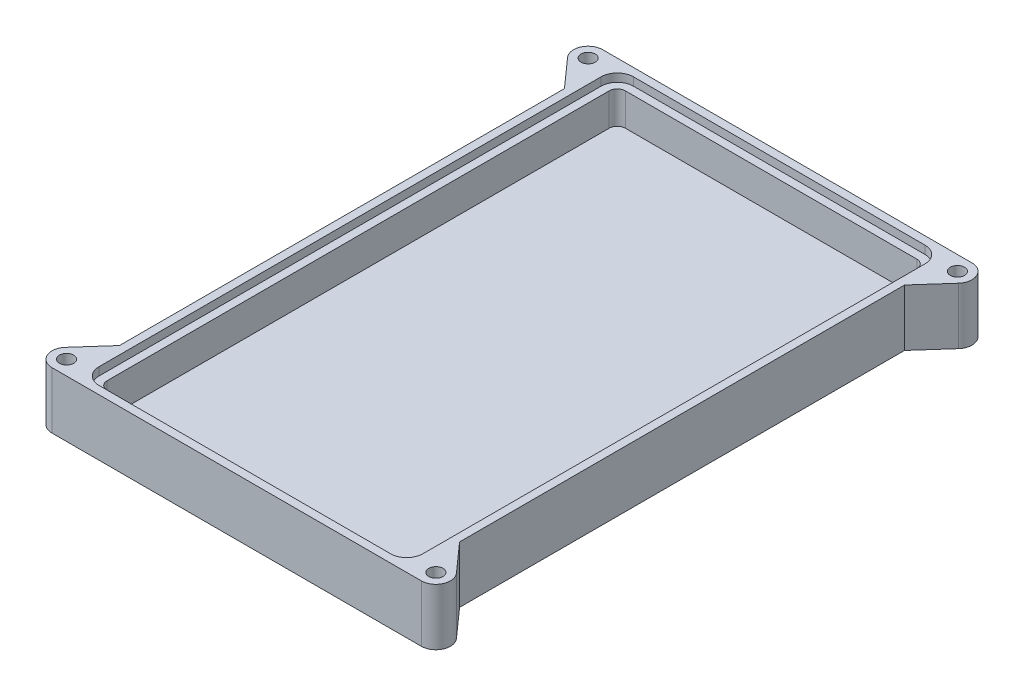
from build123d import *

# Parameters (mm, degrees)
SALIENTE_EXTRUIR2_DEPTH   = 11
SALIENTE_EXTRUIR3_DEPTH   = 25.5
SALIENTE_EXTRUIR4_DEPTH   = 2.5
SALIENTE_EXTRUIR5_DEPTH   = 36.5
SIMETR_A2_COPY_1_DEPTH    = 36.5
CROQUIS6_R                = 2.2
CORTAR_EXTRUIR2_DEPTH     = 112.083302076
SIMETR_A4_COPY_1_SKETCH_R = 2.2
SIMETR_A4_COPY_1_DEPTH    = 112.083302076
CORTAR_EXTRUIR3_DEPTH     = 6
CORTAR_EXTRUIR4_START     = -18
CORTAR_EXTRUIR4_DEPTH     = 18
CORTAR_EXTRUIR5_START     = -13
CORTAR_EXTRUIR5_DEPTH     = 13


with BuildPart() as part:
    # Croquis1 → Saliente-Extruir2 (new body)
    # profile 1 of 3: a face of its own
    with BuildSketch(Plane(origin=(0, 0, 0), x_dir=(1, 0, 0), z_dir=(0, 1, 0))):
        with BuildLine():
            Line((-45, 85), (45, 85))
            ThreePointArc((45, 85), (50.303300859, 82.803300859), (52.5, 77.5))
            Line((52.5, 77.5), (52.5, -77.5))
            ThreePointArc((52.5, -77.5), (50.303300859, -82.803300859), (45, -85))
            Line((45, -85), (-45, -85))
            ThreePointArc((-45, -85), (-50.303300859, -82.803300859), (-52.5, -77.5))
            Line((-52.5, -77.5), (-52.5, 77.5))
            ThreePointArc((-52.5, 77.5), (-50.303300859, 82.803300859), (-45, 85))
        make_face()
        with BuildLine():
            ThreePointArc((-45, 82.5), (-48.535533906, 81.035533906), (-50, 77.5))
            Line((-50, 77.5), (-50, -77.5))
            ThreePointArc((-50, -77.5), (-48.535533906, -81.035533906), (-45, -82.5))
            Line((-45, -82.5), (45, -82.5))
            ThreePointArc((45, -82.5), (48.535533906, -81.035533906), (50, -77.5))
            Line((50, -77.5), (50, 77.5))
            ThreePointArc((50, 77.5), (48.535533906, 81.035533906), (45, 82.5))
            Line((45, 82.5), (-45, 82.5))
        make_face(mode=Mode.SUBTRACT)
    # profile 2 of 3: a face of its own
    with BuildSketch(Plane(origin=(0, 0, 0), x_dir=(1, 0, 0), z_dir=(0, 1, 0))):
        with BuildLine():
            Line((-45, 82.5), (45, 82.5))
            ThreePointArc((45, 82.5), (48.535533906, 81.035533906), (50, 77.5))
            Line((50, 77.5), (50, -77.5))
            ThreePointArc((50, -77.5), (48.535533906, -81.035533906), (45, -82.5))
            Line((45, -82.5), (-45, -82.5))
            ThreePointArc((-45, -82.5), (-48.535533906, -81.035533906), (-50, -77.5))
            Line((-50, -77.5), (-50, 77.5))
            ThreePointArc((-50, 77.5), (-48.535533906, 81.035533906), (-45, 82.5))
        make_face()
        with BuildLine():
            ThreePointArc((45, -80), (46.767766953, -79.267766953), (47.5, -77.5))
            Line((47.5, -77.5), (47.5, 77.5))
            ThreePointArc((47.5, 77.5), (46.767766953, 79.267766953), (45, 80))
            Line((45, 80), (-45, 80))
            ThreePointArc((-45, 80), (-46.767766953, 79.267766953), (-47.5, 77.5))
            Line((-47.5, 77.5), (-47.5, -77.5))
            ThreePointArc((-47.5, -77.5), (-46.767766953, -79.267766953), (-45, -80))
            Line((-45, -80), (45, -80))
        make_face(mode=Mode.SUBTRACT)
    # profile 3 of 3: a face of its own
    with BuildSketch(Plane(origin=(0, 0, 0), x_dir=(1, 0, 0), z_dir=(0, 1, 0))):
        with BuildLine():
            Line((-45, -80), (45, -80))
            ThreePointArc((45, -80), (46.767766953, -79.267766953), (47.5, -77.5))
            Line((47.5, -77.5), (47.5, 77.5))
            ThreePointArc((47.5, 77.5), (46.767766953, 79.267766953), (45, 80))
            Line((45, 80), (-45, 80))
            ThreePointArc((-45, 80), (-46.767766953, 79.267766953), (-47.5, 77.5))
            Line((-47.5, 77.5), (-47.5, -77.5))
            ThreePointArc((-47.5, -77.5), (-46.767766953, -79.267766953), (-45, -80))
        make_face()
    extrude(amount=SALIENTE_EXTRUIR2_DEPTH)

    # Croquis2 → Saliente-Extruir3 (add)
    # profile 1 of 2: a face of its own
    with BuildSketch(Plane(origin=(0, 11, 0), x_dir=(1, 0, 0), z_dir=(0, 1, 0))):
        with BuildLine():
            ThreePointArc((52.5, 77.5), (50.303300859, 82.803300859), (45, 85))
            Line((45, 85), (-45, 85))
            ThreePointArc((-45, 85), (-50.303300859, 82.803300859), (-52.5, 77.5))
            Line((-52.5, 77.5), (-52.5, -77.5))
            ThreePointArc((-52.5, -77.5), (-50.303300859, -82.803300859), (-45, -85))
            Line((-45, -85), (45, -85))
            ThreePointArc((45, -85), (50.303300859, -82.803300859), (52.5, -77.5))
            Line((52.5, -77.5), (52.5, 77.5))
        make_face()
        with BuildLine():
            ThreePointArc((-45, 82.5), (-48.535533906, 81.035533906), (-50, 77.5))
            Line((-50, 77.5), (-50, -77.5))
            ThreePointArc((-50, -77.5), (-48.535533906, -81.035533906), (-45, -82.5))
            Line((-45, -82.5), (45, -82.5))
            ThreePointArc((45, -82.5), (48.535533906, -81.035533906), (50, -77.5))
            Line((50, -77.5), (50, 77.5))
            ThreePointArc((50, 77.5), (48.535533906, 81.035533906), (45, 82.5))
            Line((45, 82.5), (-45, 82.5))
        make_face(mode=Mode.SUBTRACT)
    # profile 2 of 2: a face of its own
    with BuildSketch(Plane(origin=(0, 11, 0), x_dir=(1, 0, 0), z_dir=(0, 1, 0))):
        with BuildLine():
            Line((45, 82.5), (-45, 82.5))
            ThreePointArc((-45, 82.5), (-48.535533906, 81.035533906), (-50, 77.5))
            Line((-50, 77.5), (-50, -77.5))
            ThreePointArc((-50, -77.5), (-48.535533906, -81.035533906), (-45, -82.5))
            Line((-45, -82.5), (45, -82.5))
            ThreePointArc((45, -82.5), (48.535533906, -81.035533906), (50, -77.5))
            Line((50, -77.5), (50, 77.5))
            ThreePointArc((50, 77.5), (48.535533906, 81.035533906), (45, 82.5))
        make_face()
        with BuildLine():
            ThreePointArc((-45, 80), (-46.767766953, 79.267766953), (-47.5, 77.5))
            Line((-47.5, 77.5), (-47.5, -77.5))
            ThreePointArc((-47.5, -77.5), (-46.767766953, -79.267766953), (-45, -80))
            Line((-45, -80), (45, -80))
            ThreePointArc((45, -80), (46.767766953, -79.267766953), (47.5, -77.5))
            Line((47.5, -77.5), (47.5, 77.5))
            ThreePointArc((47.5, 77.5), (46.767766953, 79.267766953), (45, 80))
            Line((45, 80), (-45, 80))
        make_face(mode=Mode.SUBTRACT)
    extrude(amount=SALIENTE_EXTRUIR3_DEPTH)

    # Croquis3 → Saliente-Extruir4 (add)
    with BuildSketch(Plane(origin=(0, 36.5, 0), x_dir=(1, 0, 0), z_dir=(0, 1, 0))):
        with BuildLine():
            Line((45, 82.5), (-45, 82.5))
            ThreePointArc((-45, 82.5), (-48.535533906, 81.035533906), (-50, 77.5))
            Line((-50, 77.5), (-50, -77.5))
            ThreePointArc((-50, -77.5), (-48.535533906, -81.035533906), (-45, -82.5))
            Line((-45, -82.5), (45, -82.5))
            ThreePointArc((45, -82.5), (48.535533906, -81.035533906), (50, -77.5))
            Line((50, -77.5), (50, 77.5))
            ThreePointArc((50, 77.5), (48.535533906, 81.035533906), (45, 82.5))
        make_face()
        with BuildLine():
            Line((-47.5, -77.5), (-47.5, 77.5))
            ThreePointArc((-47.5, 77.5), (-46.767766953, 79.267766953), (-45, 80))
            Line((-45, 80), (45, 80))
            ThreePointArc((45, 80), (46.767766953, 79.267766953), (47.5, 77.5))
            Line((47.5, 77.5), (47.5, -77.5))
            ThreePointArc((47.5, -77.5), (46.767766953, -79.267766953), (45, -80))
            Line((45, -80), (-45, -80))
            ThreePointArc((-45, -80), (-46.767766953, -79.267766953), (-47.5, -77.5))
        make_face(mode=Mode.SUBTRACT)
    extrude(amount=SALIENTE_EXTRUIR4_DEPTH)

    # Croquis4 → Saliente-Extruir5 (add)
    with BuildSketch(Plane.XZ):
        with BuildLine():
            Line((57, 85), (45, 85))
            ThreePointArc((45, 85), (50.303300859, 82.803300859), (52.5, 77.5))
            Line((52.5, 77.5), (52.5, 68.686877301))
            Line((52.5, 68.686877301), (60.359510947, 77.506058418))
            ThreePointArc((60.359510947, 77.506058418), (61.10625968, 82.340823577), (57, 85))
        make_face()
    saliente_extruir5 = extrude(amount=-SALIENTE_EXTRUIR5_DEPTH)

    # Simetría1: Saliente-Extruir5 across plane
    add(saliente_extruir5.mirror(Plane(origin=(0, 0, 0), x_dir=(0, 0, 1), z_dir=(1, 0, 0))))

    # Simetría2: Saliente-Extruir5 across plane
    add(saliente_extruir5.mirror(Plane.XY))

    # Simetría2 copy 1 sketch → Simetría2 copy 1 (add)
    with BuildSketch(Plane(origin=(0, 0, 0), x_dir=(-1, 0, 0), z_dir=(0, -1, 0))):
        with BuildLine():
            Line((57, 85), (45, 85))
            ThreePointArc((45, 85), (50.303300859, 82.803300859), (52.5, 77.5))
            Line((52.5, 77.5), (52.5, 68.686877301))
            Line((52.5, 68.686877301), (60.359510947, 77.506058418))
            ThreePointArc((60.359510947, 77.506058418), (61.10625968, 82.340823577), (57, 85))
        make_face()
    extrude(amount=-SIMETR_A2_COPY_1_DEPTH)

    # Croquis6 → Cortar-Extruir2 (cut, through all)
    with BuildSketch(Plane(origin=(0, 36.5, 0), x_dir=(1, 0, 0), z_dir=(0, 1, 0))):
        with Locations(Location((57, 80.5, 0), (0, 0, 270))):
            Circle(CROQUIS6_R)
    cortar_extruir2 = extrude(amount=-CORTAR_EXTRUIR2_DEPTH, mode=Mode.SUBTRACT)

    # Simetría3: Cortar-Extruir2 across plane
    add(cortar_extruir2.mirror(Plane(origin=(0, 0, 0), x_dir=(0, 0, 1), z_dir=(1, 0, 0))), mode=Mode.SUBTRACT)

    # Simetría4: Cortar-Extruir2 across plane
    add(cortar_extruir2.mirror(Plane.XY), mode=Mode.SUBTRACT)

    # Simetría4 copy 1 sketch → Simetría4 copy 1 (cut, through all)
    with BuildSketch(Plane(origin=(0, 36.5, 0), x_dir=(-1, 0, 0), z_dir=(0, 1, 0))):
        with Locations(Location((57, 80.5, 0), (0, 0, 270))):
            Circle(SIMETR_A4_COPY_1_SKETCH_R)
    extrude(amount=-SIMETR_A4_COPY_1_DEPTH, mode=Mode.SUBTRACT)

    # Croquis8 → Cortar-Extruir3 (cut)
    with BuildSketch(Plane.XZ):
        with BuildLine():
            Line((-57, -85), (57, -85))
            ThreePointArc((57, -85), (61.10625968, -82.340823577), (60.359510947, -77.506058418))
            Line((60.359510947, -77.506058418), (52.5, -68.686877301))
            Line((52.5, -68.686877301), (52.5, 68.686877301))
            Line((52.5, 68.686877301), (60.359510947, 77.506058418))
            ThreePointArc((60.359510947, 77.506058418), (61.10625968, 82.340823577), (57, 85))
            Line((57, 85), (-57, 85))
            ThreePointArc((-57, 85), (-61.10625968, 82.340823577), (-60.359510947, 77.506058418))
            Line((-60.359510947, 77.506058418), (-52.5, 68.686877301))
            Line((-52.5, 68.686877301), (-52.5, -68.686877301))
            Line((-52.5, -68.686877301), (-60.359510947, -77.506058418))
            ThreePointArc((-60.359510947, -77.506058418), (-61.10625968, -82.340823577), (-57, -85))
        make_face()
    extrude(amount=-CORTAR_EXTRUIR3_DEPTH, mode=Mode.SUBTRACT)

    # Croquis9 → Cortar-Extruir4 (cut)
    with BuildSketch(Plane(origin=(0, 39, 0), x_dir=(1, 0, 0), z_dir=(0, 1, 0)).offset(CORTAR_EXTRUIR4_START)):
        with BuildLine():
            Line((45, 82.5), (-45, 82.5))
            ThreePointArc((-45, 82.5), (-48.535533906, 81.035533906), (-50, 77.5))
            Line((-50, 77.5), (-50, -77.5))
            ThreePointArc((-50, -77.5), (-48.535533906, -81.035533906), (-45, -82.5))
            Line((-45, -82.5), (45, -82.5))
            ThreePointArc((45, -82.5), (48.535533906, -81.035533906), (50, -77.5))
            Line((50, -77.5), (50, 77.5))
            ThreePointArc((50, 77.5), (48.535533906, 81.035533906), (45, 82.5))
        make_face()
        with BuildLine():
            Line((-47.5, 77.5), (-47.5, -77.5))
            ThreePointArc((-47.5, -77.5), (-46.767766953, -79.267766953), (-45, -80))
            Line((-45, -80), (45, -80))
            ThreePointArc((45, -80), (46.767766953, -79.267766953), (47.5, -77.5))
            Line((47.5, -77.5), (47.5, 77.5))
            ThreePointArc((47.5, 77.5), (46.767766953, 79.267766953), (45, 80))
            Line((45, 80), (-45, 80))
            ThreePointArc((-45, 80), (-46.767766953, 79.267766953), (-47.5, 77.5))
        make_face(mode=Mode.SUBTRACT)
    extrude(amount=CORTAR_EXTRUIR4_DEPTH, mode=Mode.SUBTRACT)

    # Croquis10 → Cortar-Extruir5 (cut)
    with BuildSketch(Plane(origin=(0, 36.5, 0), x_dir=(1, 0, 0), z_dir=(0, 1, 0)).offset(CORTAR_EXTRUIR5_START)):
        with BuildLine():
            Line((57, 85), (-57, 85))
            ThreePointArc((-57, 85), (-61.10625968, 82.340823577), (-60.359510947, 77.506058418))
            Line((-60.359510947, 77.506058418), (-52.5, 68.686877301))
            Line((-52.5, 68.686877301), (-52.5, -68.686877301))
            Line((-52.5, -68.686877301), (-60.359510947, -77.506058418))
            ThreePointArc((-60.359510947, -77.506058418), (-61.10625968, -82.340823577), (-57, -85))
            Line((-57, -85), (57, -85))
            ThreePointArc((57, -85), (61.10625968, -82.340823577), (60.359510947, -77.506058418))
            Line((60.359510947, -77.506058418), (52.5, -68.686877301))
            Line((52.5, -68.686877301), (52.5, 68.686877301))
            Line((52.5, 68.686877301), (60.359510947, 77.506058418))
            ThreePointArc((60.359510947, 77.506058418), (61.10625968, 82.340823577), (57, 85))
        make_face()
    extrude(amount=CORTAR_EXTRUIR5_DEPTH, mode=Mode.SUBTRACT)


solid = part.part
